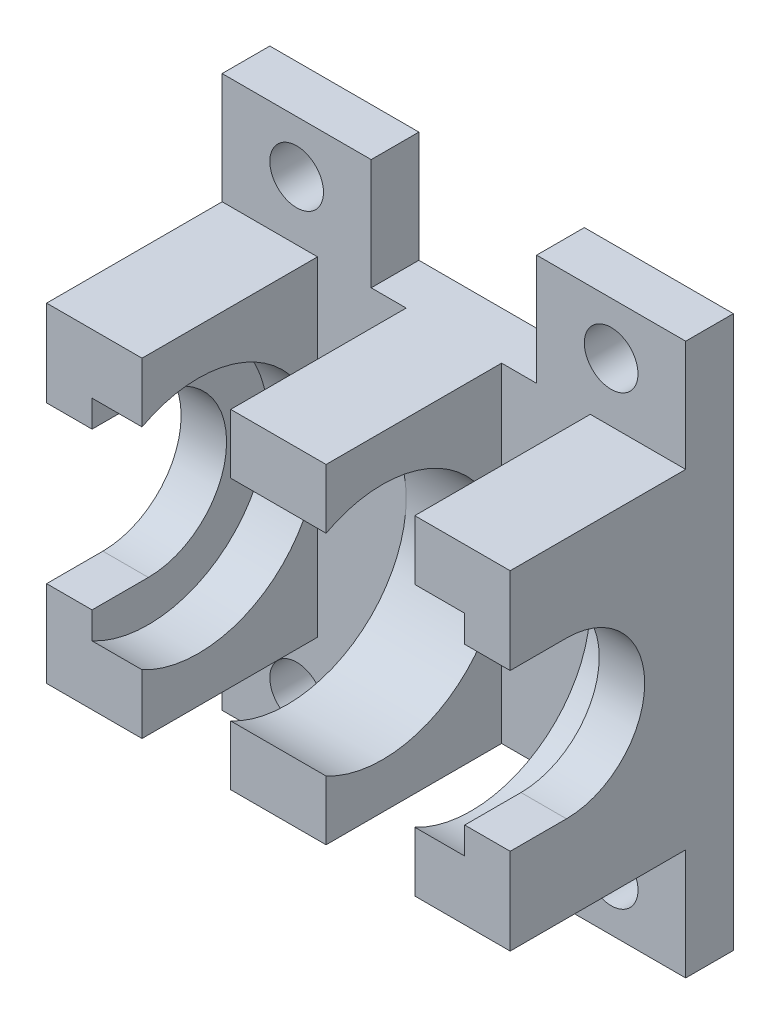
from build123d import *

# Parameters (mm, degrees)
SCHIZZO1_R         = 1.8
BASE_DEPTH         = 3.2
SCHIZZO2_W         = 6.4
SCHIZZO2_H         = 22.1
STAND_OFF_DEPTH    = 11.775
SCHIZZO3_R         = 8
BEARING_SLOT_DEPTH = 12.5
SHAFT_HOLES_REACH  = 41.163


with BuildPart() as part:
    # Schizzo1 → Base (new body)
    with BuildSketch(Plane.XY):
        Polygon((-15.55, 11.05), (-15.55, 18.5), (-5.55, 18.5), (-5.55, 11.05), (5.55, 11.05), (5.55, 18.5), (15.55, 18.5), (15.55, 11.05), (15.55, -11.05), (15.55, -18.5), (5.55, -18.5), (5.55, -11.05), (-5.55, -11.05), (-5.55, -18.5), (-15.55, -18.5), (-15.55, -11.05), align=None)
        with Locations((-10.55, 15)):
            Circle(SCHIZZO1_R, mode=Mode.SUBTRACT)
        with Locations(Location((10.55, 15, 0), (0, 0, 180))):
            Circle(SCHIZZO1_R, mode=Mode.SUBTRACT)
        with Locations((10.55, -15)):
            Circle(SCHIZZO1_R, mode=Mode.SUBTRACT)
        with Locations(Location((-10.55, -15, 0), (0, 0, 180))):
            Circle(SCHIZZO1_R, mode=Mode.SUBTRACT)
    extrude(amount=BASE_DEPTH)

    # Schizzo2 → Stand-off (add)
    with BuildSketch(Plane.XY.offset(3.2)):
        with Locations((-12.35, 0)):
            Rectangle(SCHIZZO2_W, SCHIZZO2_H)
        Rectangle(SCHIZZO2_W, SCHIZZO2_H)
        with Locations((12.35, 0)):
            Rectangle(SCHIZZO2_W, SCHIZZO2_H)
    extrude(amount=STAND_OFF_DEPTH)

    # Schizzo3 → Bearing slot (cut, symmetric)
    with BuildSketch(Plane(origin=(0, 0, 0), x_dir=(0, 0, -1), z_dir=(1, 0, 0))):
        with Locations((-11.2, 0)):
            Circle(SCHIZZO3_R)
    extrude(amount=BEARING_SLOT_DEPTH, both=True, mode=Mode.SUBTRACT)

    # Shaft holes: up to this face of the body (flat: up to its plane)
    shaft_holes_end = Plane(part.part.faces().sort_by_distance((15.55, 0, 6.746095849))[0])
    # Schizzo4 → Shaft holes (cut, up to the picked face)
    with BuildSketch(Plane.ZY.offset(15.55), mode=Mode.PRIVATE) as shaft_holes_sk1:
        with BuildLine():
            Line((11.2, 5.25), (14.975, 5.25))
            Line((14.975, 5.25), (14.975, -5.25))
            Line((14.975, -5.25), (11.2, -5.25))
            ThreePointArc((11.2, -5.25), (5.95, 0), (11.2, 5.25))
        make_face()
    shaft_holes_tool1 = split(extrude(shaft_holes_sk1.sketch, amount=-SHAFT_HOLES_REACH, mode=Mode.PRIVATE), bisect_by=shaft_holes_end, keep=Keep.BOTH, mode=Mode.PRIVATE)
    add(shaft_holes_tool1.solids().sort_by(Axis((-15.55, 0, 10.938909), (1, 0, 0)))[0], mode=Mode.SUBTRACT)


solid = part.part
